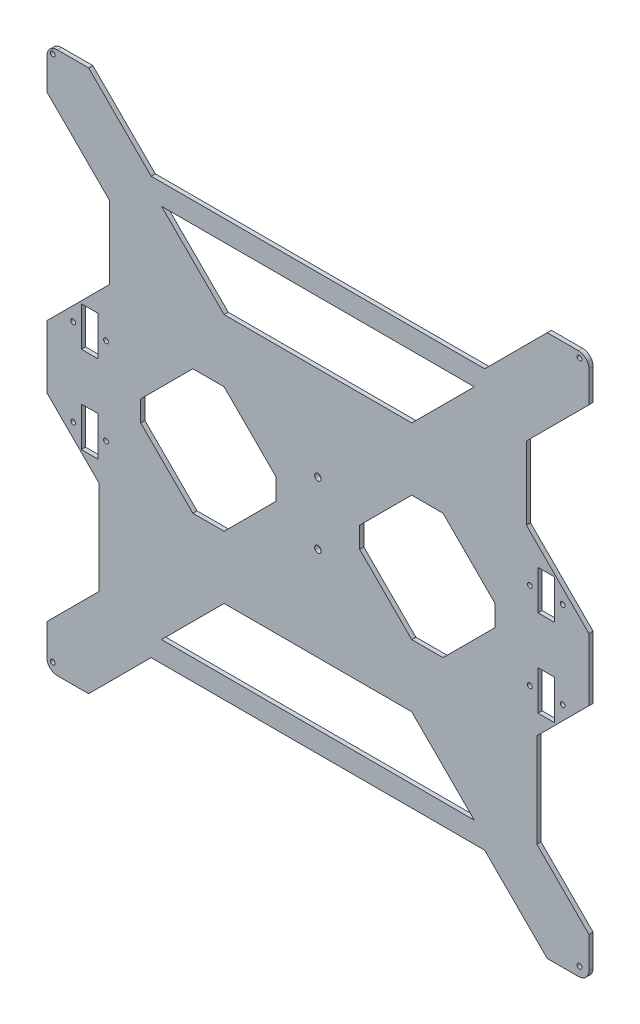
from build123d import *

# Parameters (mm, degrees)
MODEL_R             = 1.4605
MODEL_R_2           = 2
BOSS_EXTRUDE1_DEPTH = 1.27
SKETCH1_W           = 10
SKETCH1_H           = 24
CUT_EXTRUDE1_DEPTH  = 10


with BuildPart() as part:
    # Model → Boss-Extrude1 (new, symmetric)
    with BuildSketch(Plane.XY):
        with BuildLine():
            Line((-252.581304326, 70.3317), (-252.581304326, 25.8817))
            Line((-252.581304326, 25.8817), (-290.681304326, -12.2183))
            Line((-290.681304326, -12.2183), (-290.681304326, -50.3183))
            Line((-290.681304326, -50.3183), (-258.931304326, -82.0683))
            Line((-258.931304326, -82.0683), (-258.931304326, -139.2183))
            Line((-258.931304326, -139.2183), (-290.681304326, -170.9683))
            Line((-290.681304326, -170.9683), (-290.681304326, -190.0183))
            ThreePointArc((-290.681304326, -190.0183), (-288.821432386, -194.508428061), (-284.331304326, -196.3683))
            Line((-284.331304326, -196.3683), (-265.281304326, -196.3683))
            Line((-265.281304326, -196.3683), (-227.181304326, -158.2683))
            Line((-227.181304326, -158.2683), (-23.981304326, -158.2683))
            Line((-23.981304326, -158.2683), (14.118695674, -196.3683))
            Line((14.118695674, -196.3683), (33.168695674, -196.3683))
            ThreePointArc((33.168695674, -196.3683), (37.658823735, -194.508428061), (39.518695674, -190.0183))
            Line((39.518695674, -190.0183), (39.518695674, -170.9683))
            Line((39.518695674, -170.9683), (7.768695674, -139.2183))
            Line((7.768695674, -139.2183), (7.768695674, -82.0683))
            Line((7.768695674, -82.0683), (22.457936385, -67.37905929))
            Line((22.457936385, -67.37905929), (39.518695674, -50.3183))
            Line((39.518695674, -50.3183), (39.518695674, -12.2183))
            Line((39.518695674, -12.2183), (1.418695674, 25.8817))
            Line((1.418695674, 25.8817), (1.418695674, 70.3317))
            Line((1.418695674, 70.3317), (39.518695674, 108.4317))
            Line((39.518695674, 108.4317), (39.518695674, 127.4817))
            ThreePointArc((39.518695674, 127.4817), (37.658823735, 131.971828061), (33.168695674, 133.8317))
            Line((33.168695674, 133.8317), (14.118695674, 133.8317))
            Line((14.118695674, 133.8317), (-23.981304326, 95.7317))
            Line((-23.981304326, 95.7317), (-227.181304326, 95.7317))
            Line((-227.181304326, 95.7317), (-265.281304326, 133.8317))
            Line((-265.281304326, 133.8317), (-284.331304326, 133.8317))
            ThreePointArc((-284.331304326, 133.8317), (-288.821432386, 131.971828061), (-290.681304326, 127.4817))
            Line((-290.681304326, 127.4817), (-290.681304326, 108.4317))
            Line((-290.681304326, 108.4317), (-252.581304326, 70.3317))
        make_face()
        with Locations((-287.125304326, -190.6025)):
            Circle(MODEL_R, mode=Mode.SUBTRACT)
        with Locations((33.752895674, -190.6025)):
            Circle(MODEL_R, mode=Mode.SUBTRACT)
        with Locations((33.752895674, 130.2757)):
            Circle(MODEL_R, mode=Mode.SUBTRACT)
        with Locations((-287.125304326, 130.2757)):
            Circle(MODEL_R, mode=Mode.SUBTRACT)
        with Locations((-274.681304256, -57.7288)):
            Circle(MODEL_R, mode=Mode.SUBTRACT)
        with Locations((-254.681304256, -57.7288)):
            Circle(MODEL_R, mode=Mode.SUBTRACT)
        with Locations((23.518695604, -57.7288)):
            Circle(MODEL_R, mode=Mode.SUBTRACT)
        with Locations((3.518695604, -57.7288)):
            Circle(MODEL_R, mode=Mode.SUBTRACT)
        with Locations((23.518695604, -4.8078)):
            Circle(MODEL_R, mode=Mode.SUBTRACT)
        with Locations((3.518695604, -4.8078)):
            Circle(MODEL_R, mode=Mode.SUBTRACT)
        with Locations((-254.681304256, -4.8078)):
            Circle(MODEL_R, mode=Mode.SUBTRACT)
        with Locations((-274.681304256, -4.8078)):
            Circle(MODEL_R, mode=Mode.SUBTRACT)
        with Locations((-125.581304326, -12.2183)):
            Circle(MODEL_R_2, mode=Mode.SUBTRACT)
        with Locations((-125.581304326, -50.3183)):
            Circle(MODEL_R_2, mode=Mode.SUBTRACT)
        Polygon((-30.331304326, -145.5683), (-68.431304326, -107.4683), (-182.731304326, -107.4683), (-220.831304326, -145.5683), align=None, mode=Mode.SUBTRACT)
        Polygon((-220.831304326, 83.0317), (-182.731304326, 44.9317), (-68.431304326, 44.9317), (-30.331304326, 83.0317), align=None, mode=Mode.SUBTRACT)
        Polygon((-201.781304326, -69.3683), (-233.531304326, -37.6183), (-233.531304326, -24.9183), (-201.781304326, 6.8317), (-182.731304326, 6.8317), (-150.981304326, -24.9183), (-150.981304326, -37.6183), (-182.731304326, -69.3683), align=None, mode=Mode.SUBTRACT)
        Polygon((-100.181304326, -37.6183), (-100.181304326, -24.9183), (-68.431304326, 6.8317), (-49.381304326, 6.8317), (-17.631304326, -24.9183), (-17.631304326, -37.6183), (-49.381304326, -69.3683), (-68.431304326, -69.3683), align=None, mode=Mode.SUBTRACT)
    extrude(amount=BOSS_EXTRUDE1_DEPTH, both=True)

    # Sketch1 → Cut-Extrude1 (cut)
    with BuildSketch(Plane.XY.offset(1.27)):
        with Locations((-264.681304256, -57.7288)):
            Rectangle(SKETCH1_W, SKETCH1_H)
        with Locations((-264.681304256, -4.8078)):
            Rectangle(SKETCH1_W, SKETCH1_H)
        with Locations((13.518695604, -4.8078)):
            Rectangle(SKETCH1_W, SKETCH1_H)
        with Locations((13.518695604, -57.7288)):
            Rectangle(SKETCH1_W, SKETCH1_H)
    extrude(amount=-CUT_EXTRUDE1_DEPTH, mode=Mode.SUBTRACT)


solid = part.part
